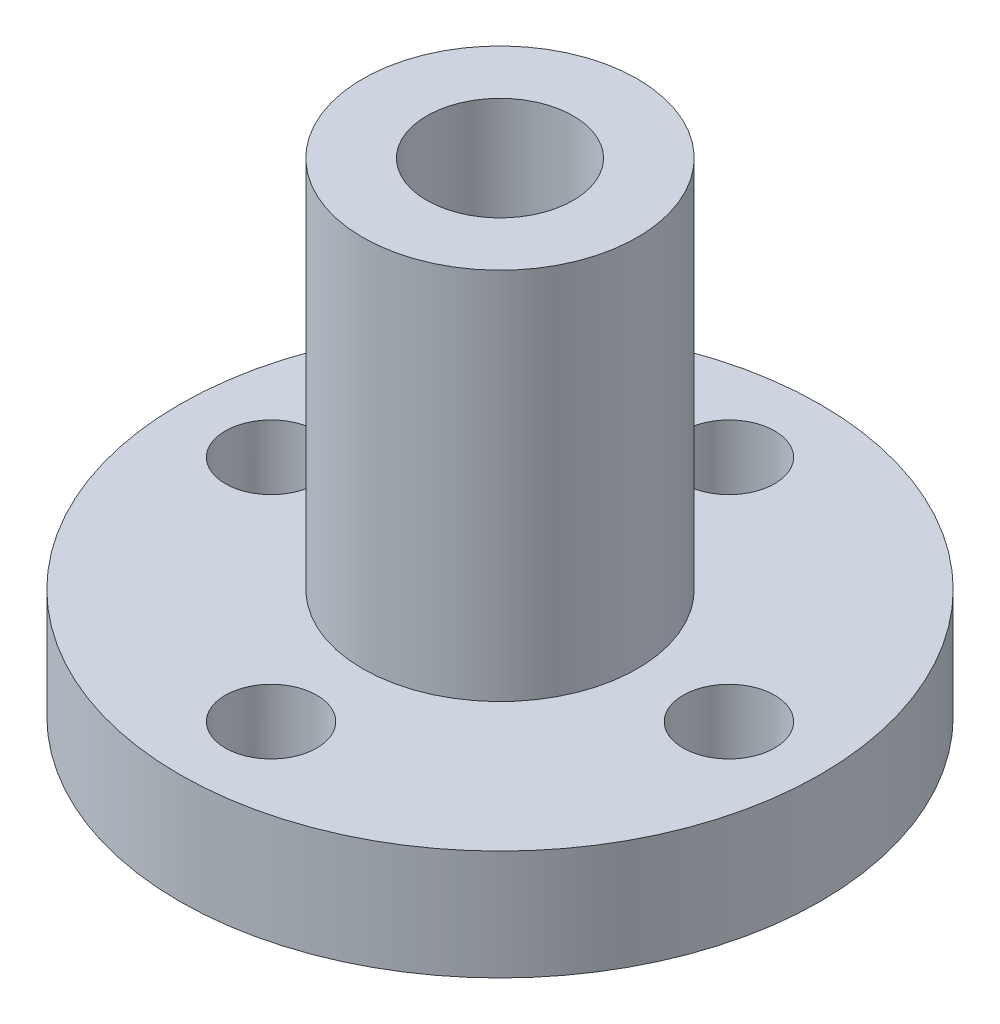
from build123d import *

# Parameters (mm, degrees)
SKETCH_1_R               = 17.5
EXTRUDE_1_DEPTH          = 6
SKETCH_3_R               = 7.5
EXTRUDE_2_DEPTH          = 20.4
SKETCH_4_R               = 4
CUT_EXTRUDE_1_DEPTH      = 37.186461557
SKETCH_5_R               = 2.5
CUT_EXTRUDE_2_DEPTH      = 10
PATTERN_CIRCULAR_1_COUNT = 4


with BuildPart() as part:
    # 草图1 → 凸台-拉伸1 (new body)
    with BuildSketch(Plane(origin=(0, 0, 0), x_dir=(1, 0, 0), z_dir=(0, 1, 0))):
        with Locations(Location((0, 0, 0), (0, 0, 270))):
            Circle(SKETCH_1_R)
    extrude(amount=EXTRUDE_1_DEPTH)

    # 草图3 → 凸台-拉伸2 (add)
    with BuildSketch(Plane(origin=(0, 6, 0), x_dir=(1, 0, 0), z_dir=(0, 1, 0))):
        with Locations(Location((0, 0, 0), (0, 0, 270))):
            Circle(SKETCH_3_R)
    extrude(amount=EXTRUDE_2_DEPTH)

    # 草图4 → 切除-拉伸1 (cut, through all)
    with BuildSketch(Plane(origin=(0, 26.4, 0), x_dir=(1, 0, 0), z_dir=(0, 1, 0))):
        with Locations(Location((0, 0, 0), (0, 0, 270))):
            Circle(SKETCH_4_R)
    extrude(amount=-CUT_EXTRUDE_1_DEPTH, mode=Mode.SUBTRACT)

    # 草图5 → 切除-拉伸2 (cut)
    with BuildSketch(Plane(origin=(0, 6, 0), x_dir=(1, 0, 0), z_dir=(0, 1, 0))):
        with Locations(Location((0, 12.5, 0), (0, 0, 270))):
            Circle(SKETCH_5_R)
    cut_extrude_2 = extrude(amount=-CUT_EXTRUDE_2_DEPTH, mode=Mode.SUBTRACT)

    # 阵列(圆周)1: 切除-拉伸2 ×4 about axis
    pattern_circular_1_axis = Axis((0, 0, 0), (0, 1, 0))
    for i in range(1, PATTERN_CIRCULAR_1_COUNT):
        add(cut_extrude_2.rotate(pattern_circular_1_axis, i * 360 / PATTERN_CIRCULAR_1_COUNT), mode=Mode.SUBTRACT)


solid = part.part
